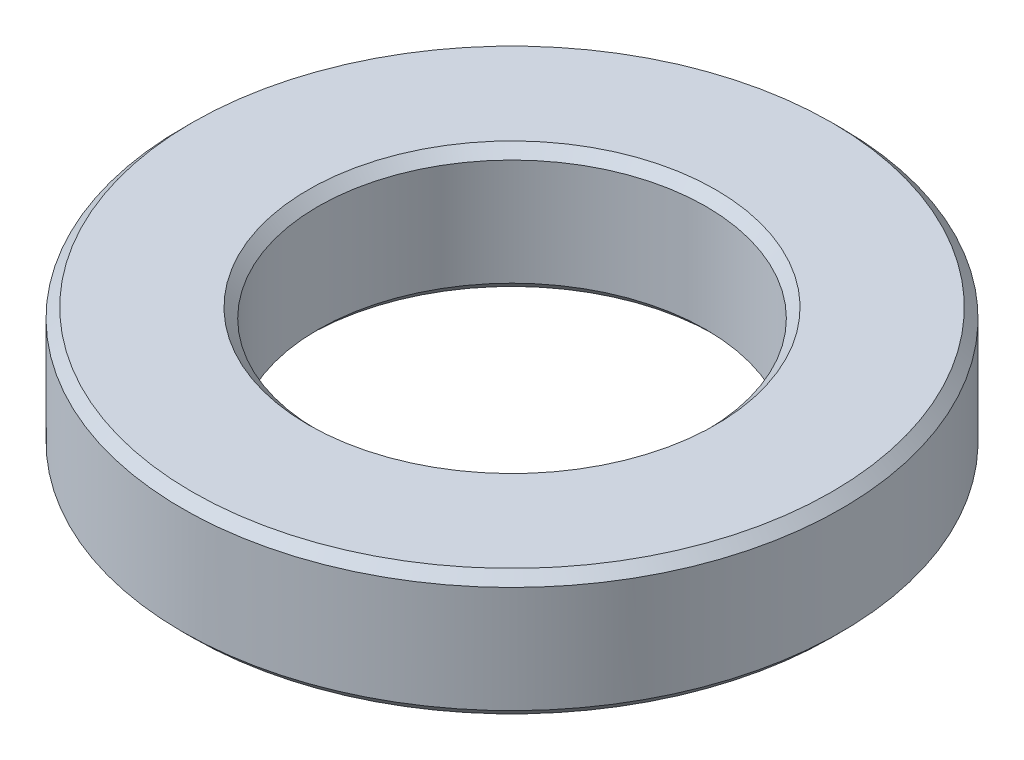
from build123d import *

# Parameters (mm, degrees)
SKETCH_1_R      = 33.99
SKETCH_1_R_2    = 20.01
EXTRUDE_1_DEPTH = 13
CHAMFER_1_SIZE  = 1


with BuildPart() as part:
    # 草图1 → 凸台-拉伸1 (new body)
    with BuildSketch(Plane(origin=(0, 0, 0), x_dir=(1, 0, 0), z_dir=(0, 1, 0))):
        with Locations(Location((0, 0, 0), (0, 0, 90))):
            Circle(SKETCH_1_R)
        with Locations(Location((0, 0, 0), (0, 0, 90))):
            Circle(SKETCH_1_R_2, mode=Mode.SUBTRACT)
    extrude(amount=EXTRUDE_1_DEPTH)

    # 倒角1
    chamfer_1_edges = [part.edges().sort_by_distance(p)[0] for p in [
        (0, 0, 33.99),
        (0, 13, 33.99),
        (0, 0, 20.01),
        (0, 13, 20.01),
    ]]
    chamfer(chamfer_1_edges, length=CHAMFER_1_SIZE)


solid = part.part
